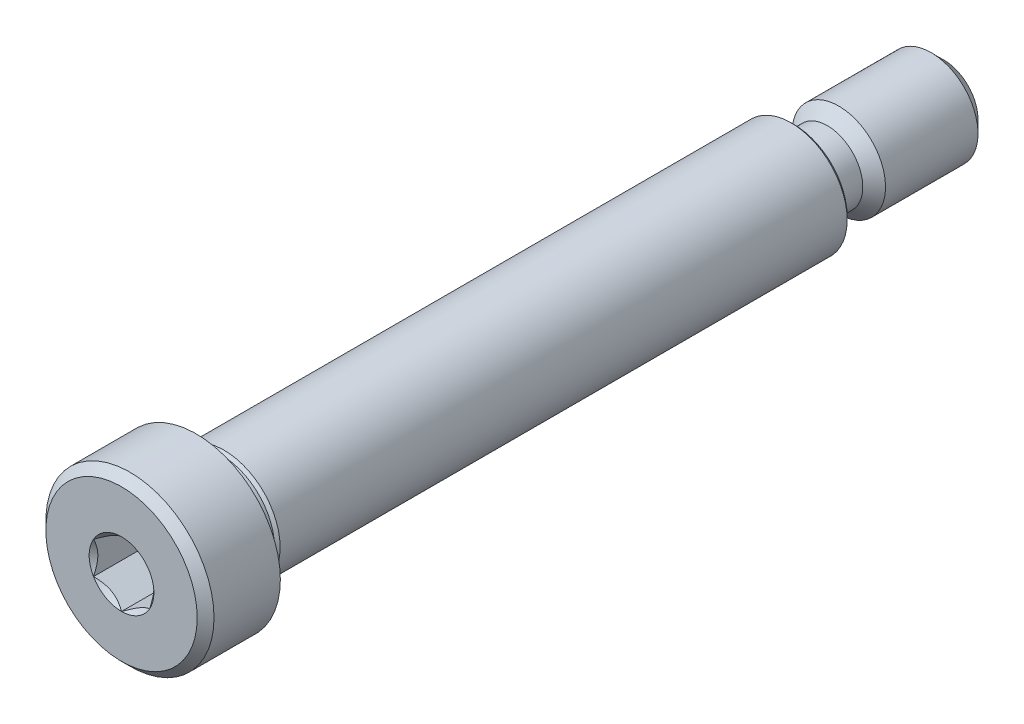
from build123d import *

# Parameters (mm, degrees)
CUT_EXTRUDE1_DEPTH = 4.7625


with BuildPart() as part:
    # Sketch4 → Revolve1 (revolve)
    with BuildSketch(Plane(origin=(0, 0, 0), x_dir=(0, 0, -1), z_dir=(1, 0, 0)), mode=Mode.PRIVATE) as revolve1_sk:
        Polygon((-28.575, 7.14375), (-34.210625, 7.14375), (-34.925, 6.429375), (-34.925, 0), (22.225, 0), (22.225, 4.500033333), (21.962533333, 4.7625), (-26.2128, 4.7625), (-26.450925, 4.524375), (-28.336875, 4.524375), (-28.575, 4.7625), align=None)
    revolve(revolve1_sk.sketch.rotate(Axis((0, 0, 34.925), (0, 0, -1)), 90), axis=Axis((0, 0, 34.925), (0, 0, -1)))

    # Sketch5 → Cut-Extrude1 (cut)
    with BuildSketch(Plane.XY.offset(34.925)):
        Polygon((2.38125, 1.374815329), (0, 2.749630657), (-2.38125, 1.374815329), (-2.38125, -1.374815329), (0, -2.749630657), (2.38125, -1.374815329), align=None)
    extrude(amount=-CUT_EXTRUDE1_DEPTH, mode=Mode.SUBTRACT)

    # Cut-Extrude4 cone 1 section (through the dimple's axis) → Cut-Extrude4 (revolve, cut)
    with BuildSketch(Plane(origin=(0, 0, 34.925), x_dir=(0, -1, 0), z_dir=(1, 0, 0))):
        Polygon((0, 0), (2.749630657, 0), (0, 2.749630657), align=None)
    revolve(axis=Axis((0, 0, 34.925), (0, 0, -1)), mode=Mode.SUBTRACT)

    # Sketch7 → Revolve2 (revolve)
    with BuildSketch(Plane(origin=(0, 0, 0), x_dir=(0, 0, -1), z_dir=(1, 0, 0)), mode=Mode.PRIVATE) as revolve2_sk:
        Polygon((22.225, 3.9751), (33.866666667, 3.9751), (34.925, 2.916766667), (34.925, 0), (22.225, 0), align=None)
    revolve(revolve2_sk.sketch.rotate(Axis((0, 0, -34.925), (0, 0, 1)), 90), axis=Axis((0, 0, -34.925), (0, 0, 1)))

    # Sketch10 → Cut-Revolve1 (revolve, cut)
    with BuildSketch(Plane(origin=(0, 0, 0), x_dir=(0, 0, -1), z_dir=(1, 0, 0)), mode=Mode.PRIVATE) as cut_revolve1_sk:
        with BuildLine():
            Line((23.1902, 3.0099), (25.0444, 3.0099))
            Line((25.0444, 3.0099), (26.797, 4.7625))
            Line((26.797, 4.7625), (22.225, 4.7625))
            Line((22.225, 4.7625), (22.225, 3.9751))
            ThreePointArc((22.225, 3.9751), (22.507700535, 3.292600535), (23.1902, 3.0099))
        make_face()
    revolve(cut_revolve1_sk.sketch.rotate(Axis((0, 0, -34.925), (0, 0, 1)), 90), axis=Axis((0, 0, -34.925), (0, 0, 1)), mode=Mode.SUBTRACT)


solid = part.part
